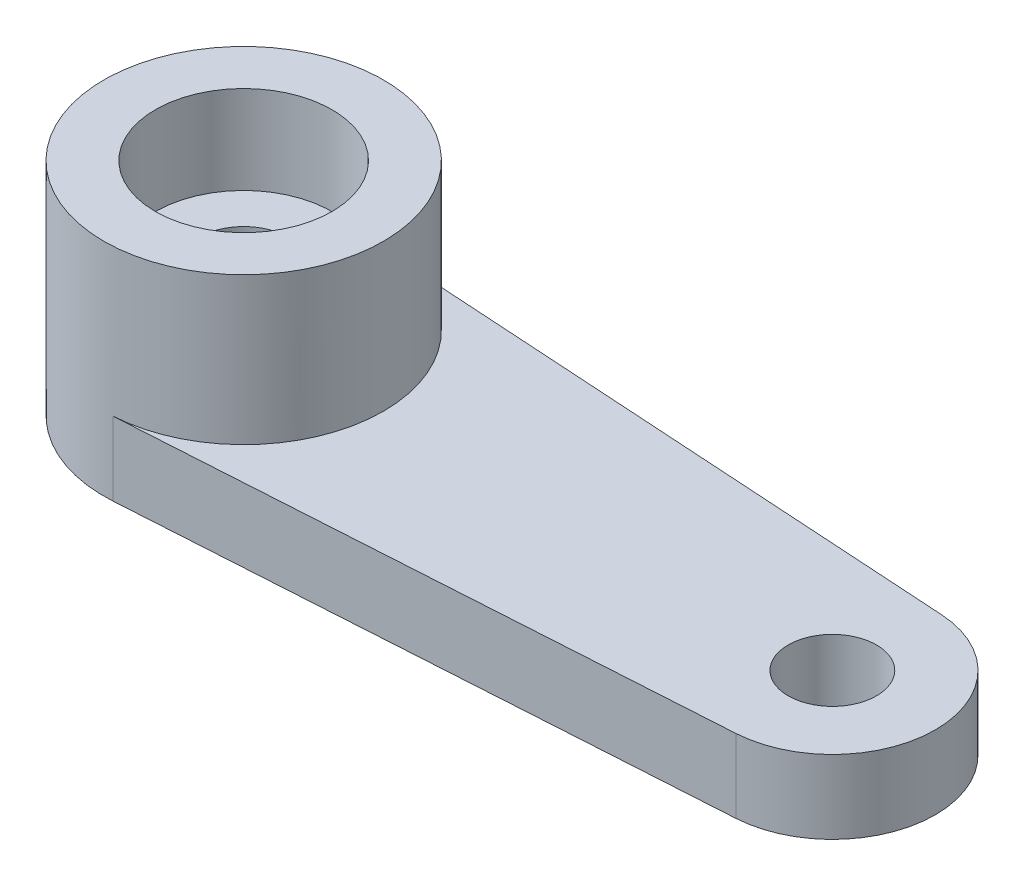
from build123d import *
from build123d.topology import SkipClean

# Parameters (mm, degrees)
SKETCH_1_R          = 3
SKETCH_1_R_2        = 1.5
EXTRUDE_1_DEPTH     = 2.5
SKETCH_2_R          = 4.75
EXTRUDE_2_DEPTH     = 5
CUT_EXTRUDE_START   = -3
SKETCH_3_R          = 3
CUT_EXTRUDE_1_DEPTH = 3
SKETCH_4_R          = 1.5
CUT_EXTRUDE_2_DEPTH = 3


with BuildPart() as part:
    # 草图1 → 凸台-拉伸1 (new body)
    with BuildSketch(Plane(origin=(0, 0, 0), x_dir=(1, 0, 0), z_dir=(0, 1, 0))):
        with BuildLine():
            Line((0.296875, 4.740713579), (20.21875, 3.493157374))
            ThreePointArc((20.21875, 3.493157374), (23.5, 0), (20.21875, -3.493157374))
            Line((20.21875, -3.493157374), (0.296875, -4.740713579))
            ThreePointArc((0.296875, -4.740713579), (-4.75, 0), (0.296875, 4.740713579))
        make_face()
        with Locations(Location((0, 0, 0), (0, 0, 270))):
            Circle(SKETCH_1_R, mode=Mode.SUBTRACT)
        with Locations(Location((20, 0, 0), (0, 0, 270))):
            Circle(SKETCH_1_R_2, mode=Mode.SUBTRACT)
    extrude(amount=EXTRUDE_1_DEPTH)

    # 草图2 → 凸台-拉伸2 (add)
    with SkipClean():  # the faces are left unmerged after this step: merging them gives an invalid solid
        with BuildSketch(Plane(origin=(0, 2.5, 0), x_dir=(1, 0, 0), z_dir=(0, 1, 0))):
            with Locations(Location((0, 0, 0), (0, 0, 86.416678302))):
                Circle(SKETCH_2_R)
        extrude(amount=EXTRUDE_2_DEPTH)

    # 草图3 → 切除-拉伸1 (cut)
    with SkipClean():  # the faces are left unmerged after this step: merging them gives an invalid solid
        with BuildSketch(Plane(origin=(0, 7.5, 0), x_dir=(1, 0, 0), z_dir=(0, 1, 0)).offset(CUT_EXTRUDE_START)):
            with Locations(Location((0, 0, 0), (0, 0, 270))):
                Circle(SKETCH_3_R)
        extrude(amount=CUT_EXTRUDE_1_DEPTH, mode=Mode.SUBTRACT)

    # 草图4 → 切除-拉伸2 (cut)
    with SkipClean():  # the faces are left unmerged after this step: merging them gives an invalid solid
        with BuildSketch(Plane.XZ.offset(-2.5)):
            with Locations(Location((0, 0, 0), (0, 0, 270))):
                Circle(SKETCH_4_R)
        extrude(amount=-CUT_EXTRUDE_2_DEPTH, mode=Mode.SUBTRACT)


solid = part.part
